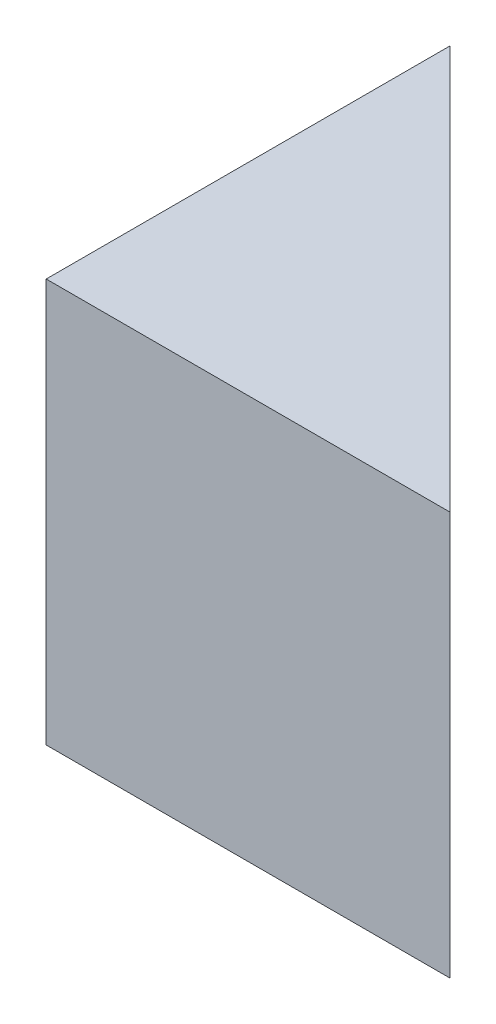
from build123d import *

# Parameters (mm, degrees)
BOSS_EXTRUDE1_DEPTH = 30


with BuildPart() as part:
    # Sketch1 → Boss-Extrude1 (new body)
    with BuildSketch(Plane(origin=(0, 0, 0), x_dir=(1, 0, 0), z_dir=(0, 1, 0))):
        Polygon((0, 0), (30, 0), (0, 30), align=None)
    extrude(amount=BOSS_EXTRUDE1_DEPTH)


solid = part.part
